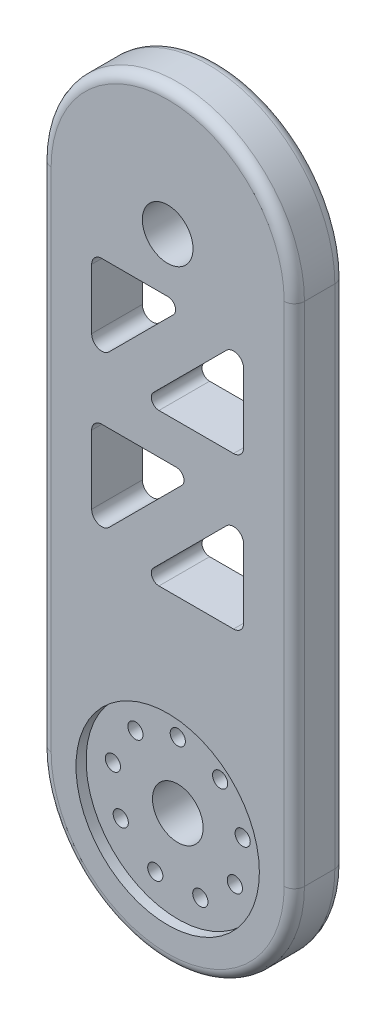
from build123d import *

# Parameters (mm, degrees)
SKETCH1_R           = 5
BOSS_EXTRUDE1_DEPTH = 10
CUT_EXTRUDE2_DEPTH  = 10
FILLET1_R           = 2
FILLET2_R           = 2
SKETCH3_R           = 18.1
CUT_EXTRUDE3_DEPTH  = 2
SKETCH4_R           = 1.5
CUT_EXTRUDE4_DEPTH  = 136.00000013
SKETCH4_3_R         = 3
SKETCH4_3_R_2       = 1.5
CUT_EXTRUDE5_DEPTH  = 2
CIRPATTERN1_COUNT   = 9


with BuildPart() as part:
    # Sketch1 → Boss-Extrude1 (new body)
    with BuildSketch(Plane.XY):
        with BuildLine():
            Line((0, 100), (0, 0))
            ThreePointArc((0, 0), (25, -25), (50, 0))
            Line((50, 0), (50, 100))
            ThreePointArc((50, 100), (25, 125), (0, 100))
        make_face()
        with Locations((25, 0)):
            Circle(SKETCH1_R, mode=Mode.SUBTRACT)
        with Locations((25, 100)):
            Circle(SKETCH1_R, mode=Mode.SUBTRACT)
    extrude(amount=BOSS_EXTRUDE1_DEPTH)

    # Sketch2 → Cut-Extrude2 (cut)
    with BuildSketch(Plane.XY.offset(10)):
        with BuildLine():
            Line((25.064971157, 89.343145751), (10, 89.343145751))
            Line((10, 89.343145751), (10, 70.656854249))
            Line((10, 70.656854249), (26.125631329, 86.782485579))
            ThreePointArc((26.125631329, 86.782485579), (26.450790456, 88.417170899), (25.064971157, 89.343145751))
        make_face()
        with BuildLine():
            Line((40, 69), (40, 89.343145751))
            Line((40, 89.343145751), (22.217514421, 71.560660172))
            ThreePointArc((22.217514421, 71.560660172), (21.892355294, 69.925974851), (23.278174593, 69))
            Line((23.278174593, 69), (40, 69))
        make_face()
        with BuildLine():
            Line((26.721825407, 61), (10, 61))
            Line((10, 61), (10, 40.65685425))
            Line((10, 40.65685425), (27.782485579, 58.439339828))
            ThreePointArc((27.782485579, 58.439339828), (28.107644706, 60.074025149), (26.721825407, 61))
        make_face()
        with BuildLine():
            Line((40, 39), (40, 59.343145751))
            Line((40, 59.343145751), (22.217514421, 41.560660172))
            ThreePointArc((22.217514421, 41.560660172), (21.892355294, 39.925974852), (23.278174593, 39))
            Line((23.278174593, 39), (40, 39))
        make_face()
    extrude(amount=-CUT_EXTRUDE2_DEPTH, mode=Mode.SUBTRACT)

    # Fillet1
    fillet1_edges = [part.edges().sort_by_distance(p)[0] for p in [
        (40, 89.343145751, 5),
        (40, 69, 5),
        (10, 89.343145751, 5),
        (10, 70.656854249, 5),
        (10, 40.65685425, 5),
        (10, 61, 5),
        (40, 59.343145751, 5),
        (40, 39, 5),
    ]]
    fillet(fillet1_edges, radius=FILLET1_R)

    # Fillet2
    fillet2_edges = [part.edges().sort_by_distance(p)[0] for p in [
        (25, -25, 10),
        (50, 50, 10),
        (25, 125, 10),
        (25, -25, 0),
        (50, 50, 0),
        (25, 125, 0),
        (0, 50, 10),
        (0, 50, 0),
    ]]
    fillet(fillet2_edges, radius=FILLET2_R)

    # Sketch3 → Cut-Extrude3 (cut)
    with BuildSketch(Plane.XY.offset(10)):
        with Locations((25, 0)):
            Circle(SKETCH3_R)
    extrude(amount=-CUT_EXTRUDE3_DEPTH, mode=Mode.SUBTRACT)

    # Sketch4 → Cut-Extrude4 (cut, through all)
    with BuildSketch(Plane(origin=(0, 0, 0), x_dir=(-1, 0, 0), z_dir=(0, 0, -1))):
        with Locations((-25, 13)):
            Circle(SKETCH4_R)
    cut_extrude4 = extrude(amount=-CUT_EXTRUDE4_DEPTH, mode=Mode.SUBTRACT)

    # Sketch4<3> → Cut-Extrude5 (cut)
    with BuildSketch(Plane(origin=(0, 0, 0), x_dir=(-1, 0, 0), z_dir=(0, 0, -1))):
        with Locations((-25, 13)):
            Circle(SKETCH4_3_R)
        with Locations((-25, 13)):
            Circle(SKETCH4_3_R_2, mode=Mode.SUBTRACT)
    cut_extrude5 = extrude(amount=-CUT_EXTRUDE5_DEPTH, mode=Mode.SUBTRACT)

    # CirPattern1: Cut-Extrude4, Cut-Extrude5 ×9 about axis
    cirpattern1_axis = Axis((25, 0, 8), (0, 0, -1))
    add([cut_extrude4.rotate(cirpattern1_axis, i * 360 / CIRPATTERN1_COUNT) for i in range(1, CIRPATTERN1_COUNT)], mode=Mode.SUBTRACT)
    add([cut_extrude5.rotate(cirpattern1_axis, i * 360 / CIRPATTERN1_COUNT) for i in range(1, CIRPATTERN1_COUNT)], mode=Mode.SUBTRACT)


solid = part.part
